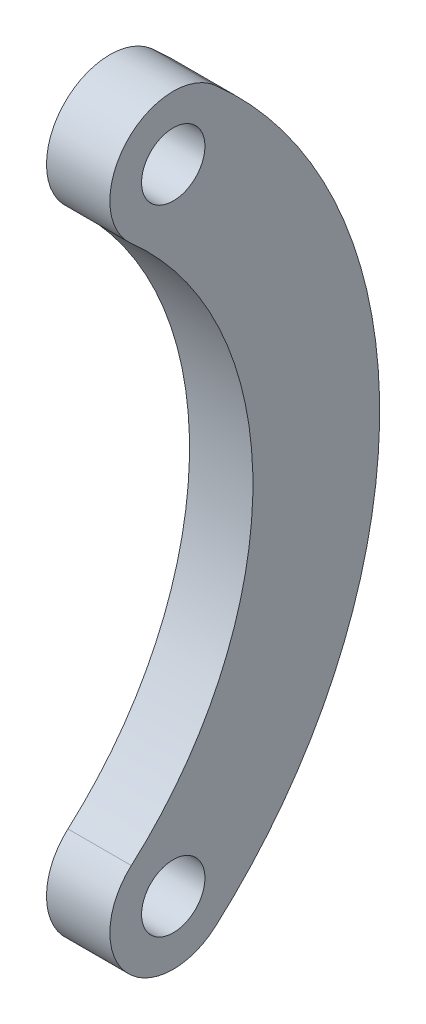
from build123d import *

# Parameters (mm, degrees)
SKETCH1_R           = 9.525
BOSS_EXTRUDE1_DEPTH = 19.05


with BuildPart() as part:
    # Sketch1 → Boss-Extrude1 (new body)
    with BuildSketch(Plane.YZ):
        with BuildLine():
            ThreePointArc((109.5375, -96.602994745), (0, -146.05), (-109.5375, -96.602994745))
            ThreePointArc((-109.5375, -96.602994745), (-107.850390619, -69.715104126), (-80.9625, -71.402213507))
            ThreePointArc((-80.9625, -71.402213507), (0, -107.95), (80.9625, -71.402213507))
            ThreePointArc((80.9625, -71.402213507), (107.850390619, -69.715104126), (109.5375, -96.602994745))
        make_face()
        with Locations(Location((-95.25, -84.002604126, 0), (0, 0, 90))):
            Circle(SKETCH1_R, mode=Mode.SUBTRACT)
        with Locations(Location((95.25, -84.002604126, 0), (0, 0, 90))):
            Circle(SKETCH1_R, mode=Mode.SUBTRACT)
    extrude(amount=BOSS_EXTRUDE1_DEPTH)


solid = part.part
